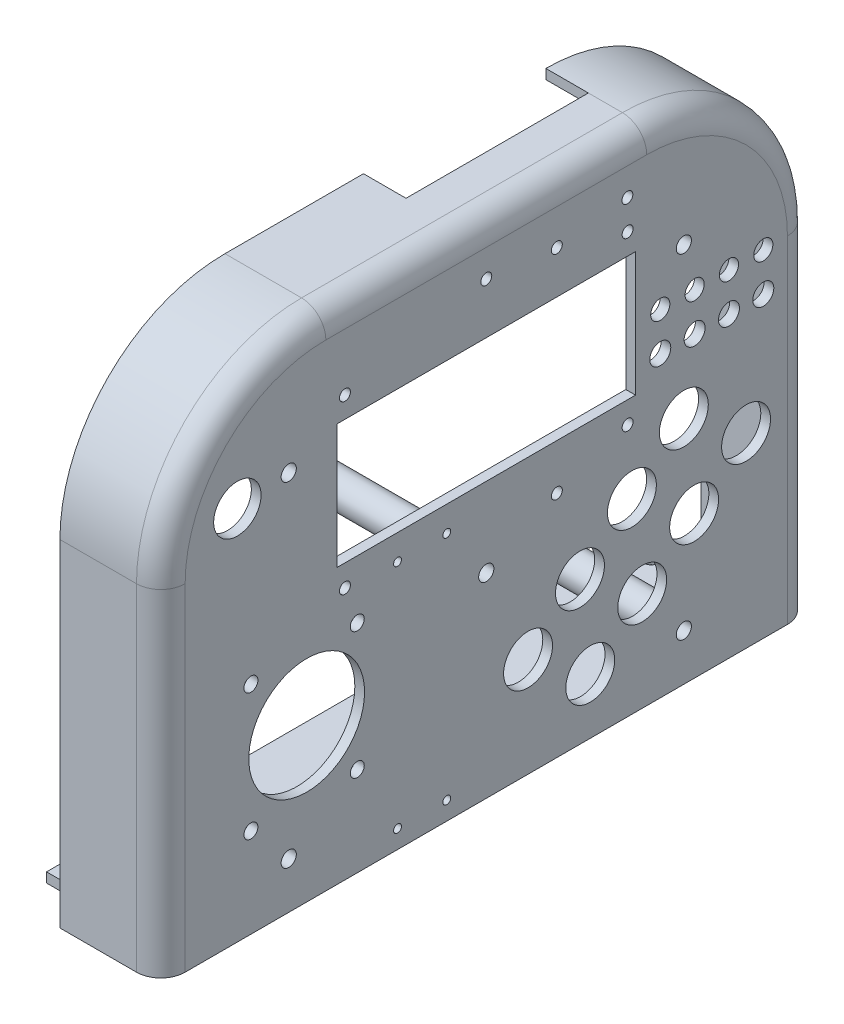
from build123d import *
from build123d.topology import SkipClean

# Parameters (mm, degrees)
SKETCH1_R           = 1.8
SKETCH1_R_2         = 3.15
SKETCH1_R_3         = 8.05
SKETCH1_R_4         = 2.3
SKETCH1_R_5         = 19.05
SKETCH1_R_6         = 2.5
SKETCH1_R_7         = 7.8
SKETCH1_R_8         = 1.3
SKETCH1_R_9         = 3.45
SKETCH1_W           = 98.2
SKETCH1_H           = 40.9
BOSS_EXTRUDE1_DEPTH = 3.2
BOSS_EXTRUDE2_START = 30
BOSS_EXTRUDE2_DEPTH = 30
FILLET1_R           = 4.8
FILLET2_R           = 8
BOSS_EXTRUDE3_START = 50
SKETCH6_R           = 5.25
SKETCH6_R_2         = 2.5
BOSS_EXTRUDE3_DEPTH = 50
SKETCH12_W          = 192.98
SKETCH12_H          = 3.2
BOSS_EXTRUDE7_DEPTH = 15
SKETCH8_R           = 2.3
CUT_EXTRUDE2_DEPTH  = 10
SKETCH19_W          = 14
SKETCH19_H          = 60
CUT_EXTRUDE7_DEPTH  = 10


with BuildPart() as part:
    # Sketch1 → Boss-Extrude1 (new body)
    with BuildSketch(Plane(origin=(0, 0, 0), x_dir=(0, 0, -1), z_dir=(1, 0, 0))):
        with BuildLine():
            Line((-52.79, 54.2), (52.79, 54.2))
            ThreePointArc((52.79, 54.2), (91.185898218, 38.295898218), (107.09, -0.1))
            Line((107.09, -0.1), (107.09, -110.8))
            Line((107.09, -110.8), (-107.09, -110.8))
            Line((-107.09, -110.8), (-107.09, -0.1))
            ThreePointArc((-107.09, -0.1), (-91.185898218, 38.295898218), (-52.79, 54.2))
        make_face()
        with Locations((46.5, 27.4)):
            Circle(SKETCH1_R, mode=Mode.SUBTRACT)
        with Locations((-46.5, -27.6)):
            Circle(SKETCH1_R, mode=Mode.SUBTRACT)
        with Locations((-46.5, 27.4)):
            Circle(SKETCH1_R, mode=Mode.SUBTRACT)
        with Locations((46.5, -27.6)):
            Circle(SKETCH1_R, mode=Mode.SUBTRACT)
        with Locations((57.25, -0.1)):
            Circle(SKETCH1_R_2, mode=Mode.SUBTRACT)
        with Locations((68.55, -0.1)):
            Circle(SKETCH1_R_2, mode=Mode.SUBTRACT)
        with Locations((79.85, -0.1)):
            Circle(SKETCH1_R_2, mode=Mode.SUBTRACT)
        with Locations((91.15, -0.1)):
            Circle(SKETCH1_R_2, mode=Mode.SUBTRACT)
        with Locations((65, -35.1)):
            Circle(SKETCH1_R_3, mode=Mode.SUBTRACT)
        with Locations((85.478801107, -49.439410909)):
            Circle(SKETCH1_R_3, mode=Mode.SUBTRACT)
        with Locations((68.389756641, -63.778821818)):
            Circle(SKETCH1_R_3, mode=Mode.SUBTRACT)
        with Locations((51.300712175, -78.118232726)):
            Circle(SKETCH1_R_3, mode=Mode.SUBTRACT)
        with Locations((34.211667709, -92.457643635)):
            Circle(SKETCH1_R_3, mode=Mode.SUBTRACT)
        with Locations((47.910955534, -49.439410909)):
            Circle(SKETCH1_R_3, mode=Mode.SUBTRACT)
        with Locations((30.821911068, -63.778821818)):
            Circle(SKETCH1_R_3, mode=Mode.SUBTRACT)
        with Locations((13.732866601, -78.118232726)):
            Circle(SKETCH1_R_3, mode=Mode.SUBTRACT)
        with Locations((-77.45, -81.35)):
            Circle(SKETCH1_R_4, mode=Mode.SUBTRACT)
        with Locations((-42.45, -81.35)):
            Circle(SKETCH1_R_4, mode=Mode.SUBTRACT)
        with Locations((-42.45, -39.55)):
            Circle(SKETCH1_R_4, mode=Mode.SUBTRACT)
        with Locations((-77.45, -39.55)):
            Circle(SKETCH1_R_4, mode=Mode.SUBTRACT)
        with Locations((-59.1, -60.45)):
            Circle(SKETCH1_R_5, mode=Mode.SUBTRACT)
        with Locations((-65, -95.5)):
            Circle(SKETCH1_R_6, mode=Mode.SUBTRACT)
        with Locations((65, -95.5)):
            Circle(SKETCH1_R_6, mode=Mode.SUBTRACT)
        with Locations((65, 14.5)):
            Circle(SKETCH1_R_6, mode=Mode.SUBTRACT)
        with Locations((-65, 14.5)):
            Circle(SKETCH1_R_6, mode=Mode.SUBTRACT)
        with Locations((-81.9, 12.7)):
            Circle(SKETCH1_R_7, mode=Mode.SUBTRACT)
        with Locations((0, -46.55)):
            Circle(SKETCH1_R_6, mode=Mode.SUBTRACT)
        with Locations((46.42, 37.2)):
            Circle(SKETCH1_R, mode=Mode.SUBTRACT)
        with Locations((0, 37.2)):
            Circle(SKETCH1_R, mode=Mode.SUBTRACT)
        with Locations((23.21, 34.55)):
            Circle(SKETCH1_R, mode=Mode.SUBTRACT)
        with Locations((23.21, -35.45)):
            Circle(SKETCH1_R, mode=Mode.SUBTRACT)
        with Locations((-29.2, -28.8)):
            Circle(SKETCH1_R_8, mode=Mode.SUBTRACT)
        with Locations((-13, -28.8)):
            Circle(SKETCH1_R_8, mode=Mode.SUBTRACT)
        with Locations((-13, -104.8)):
            Circle(SKETCH1_R_8, mode=Mode.SUBTRACT)
        with Locations((-29.2, -104.8)):
            Circle(SKETCH1_R_8, mode=Mode.SUBTRACT)
        with Locations((91.15, -12.7)):
            Circle(SKETCH1_R_9, mode=Mode.SUBTRACT)
        with Locations((79.85, -12.7)):
            Circle(SKETCH1_R_9, mode=Mode.SUBTRACT)
        with Locations((68.55, -12.7)):
            Circle(SKETCH1_R_9, mode=Mode.SUBTRACT)
        with Locations((57.25, -12.7)):
            Circle(SKETCH1_R_9, mode=Mode.SUBTRACT)
        Rectangle(SKETCH1_W, SKETCH1_H, mode=Mode.SUBTRACT)
    extrude(amount=BOSS_EXTRUDE1_DEPTH)

    # Sketch3 → Boss-Extrude2 (add)
    with BuildSketch(Plane.ZY.offset(BOSS_EXTRUDE2_START)):
        with BuildLine():
            Line((-107.09, -0.1), (-107.09, -110.8))
            Line((-107.09, -110.8), (107.09, -110.8))
            Line((107.09, -110.8), (107.09, -0.1))
            ThreePointArc((107.09, -0.1), (91.185898218, 38.295898218), (52.79, 54.2))
            Line((52.79, 54.2), (-52.79, 54.2))
            ThreePointArc((-52.79, 54.2), (-91.185898218, 38.295898218), (-107.09, -0.1))
        make_face()
        with BuildLine():
            Line((-103.89, -0.1), (-103.89, -107.6))
            Line((-103.89, -107.6), (103.89, -107.6))
            Line((103.89, -107.6), (103.89, -0.1))
            ThreePointArc((103.89, -0.1), (88.923156519, 36.033156519), (52.79, 51))
            Line((52.79, 51), (-52.79, 51))
            ThreePointArc((-52.79, 51), (-88.923156519, 36.033156519), (-103.89, -0.1))
        make_face(mode=Mode.SUBTRACT)
    extrude(amount=-BOSS_EXTRUDE2_DEPTH)

    # Fillet1
    fillet1_edges = [part.edges().sort_by_distance(p)[0] for p in [
        (0, 36.033156519, -88.923156519),
        (0, -53.85, -103.89),
        (0, -53.85, 103.89),
        (0, 36.033156519, 88.923156519),
        (0, 51, 0),
    ]]
    fillet(fillet1_edges, radius=FILLET1_R)

    # Fillet2
    fillet2_edges = [part.edges().sort_by_distance(p)[0] for p in [
        (3.2, 38.295898218, 91.185898218),
        (3.2, -55.45, 107.09),
        (3.2, -55.45, -107.09),
        (3.2, 38.295898218, -91.185898218),
        (3.2, 54.2, 0),
    ]]
    fillet(fillet2_edges, radius=FILLET2_R)

    # Sketch6 → Boss-Extrude3 (add)
    # profile 1 of 5: a face of its own
    with SkipClean():  # the faces are left unmerged after this step: merging them gives an invalid solid
        with BuildSketch(Plane.ZY.offset(BOSS_EXTRUDE3_START)):
            with Locations((65, 14.5)):
                Circle(SKETCH6_R)
            with Locations((65, 14.5)):
                Circle(SKETCH6_R_2, mode=Mode.SUBTRACT)
        # profile 2 of 5: a face of its own
        with BuildSketch(Plane.ZY.offset(BOSS_EXTRUDE3_START)):
            with Locations((-65, 14.5)):
                Circle(SKETCH6_R)
            with Locations((-65, 14.5)):
                Circle(SKETCH6_R_2, mode=Mode.SUBTRACT)
        # profile 3 of 5: a face of its own
        with BuildSketch(Plane.ZY.offset(BOSS_EXTRUDE3_START)):
            with Locations((-65, -95.5)):
                Circle(SKETCH6_R)
            with Locations((-65, -95.5)):
                Circle(SKETCH6_R_2, mode=Mode.SUBTRACT)
        # profile 4 of 5: a face of its own
        with BuildSketch(Plane.ZY.offset(BOSS_EXTRUDE3_START)):
            with Locations((65, -95.5)):
                Circle(SKETCH6_R)
            with Locations((65, -95.5)):
                Circle(SKETCH6_R_2, mode=Mode.SUBTRACT)
        # profile 5 of 5: a face of its own
        with BuildSketch(Plane.ZY.offset(BOSS_EXTRUDE3_START)):
            with Locations((0, -46.55)):
                Circle(SKETCH6_R)
            with Locations((0, -46.55)):
                Circle(SKETCH6_R_2, mode=Mode.SUBTRACT)
        extrude(amount=-BOSS_EXTRUDE3_DEPTH)

    # Sketch12 → Boss-Extrude7 (add)
    with SkipClean():  # the faces are left unmerged after this step: merging them gives an invalid solid
        with BuildSketch(Plane.ZY.offset(30)):
            with Locations((0, -109.2)):
                Rectangle(SKETCH12_W, SKETCH12_H)
        extrude(amount=BOSS_EXTRUDE7_DEPTH)

    # Sketch8 → Cut-Extrude2 (cut)
    with SkipClean():  # the faces are left unmerged after this step: merging them gives an invalid solid
        with BuildSketch(Plane.XZ.offset(110.8)):
            with Locations(Location((-14.6, 92.09, 0), (0, 0, 270))):
                Circle(SKETCH8_R)
            with Locations(Location((-34.6, 92.09, 0), (0, 0, 270))):
                Circle(SKETCH8_R)
            with Locations(Location((-14.6, -92.09, 0), (0, 0, 270))):
                Circle(SKETCH8_R)
            with Locations(Location((-34.6, -92.09, 0), (0, 0, 270))):
                Circle(SKETCH8_R)
        extrude(amount=-CUT_EXTRUDE2_DEPTH, mode=Mode.SUBTRACT)

    # Sketch19 → Cut-Extrude7 (cut)
    with SkipClean():  # the faces are left unmerged after this step: merging them gives an invalid solid
        with BuildSketch(Plane(origin=(0, 54.2, 0), x_dir=(1, 0, 0), z_dir=(0, 1, 0))):
            with Locations((-23, 22.79)):
                Rectangle(SKETCH19_W, SKETCH19_H)
        extrude(amount=-CUT_EXTRUDE7_DEPTH, mode=Mode.SUBTRACT)


solid = part.part
